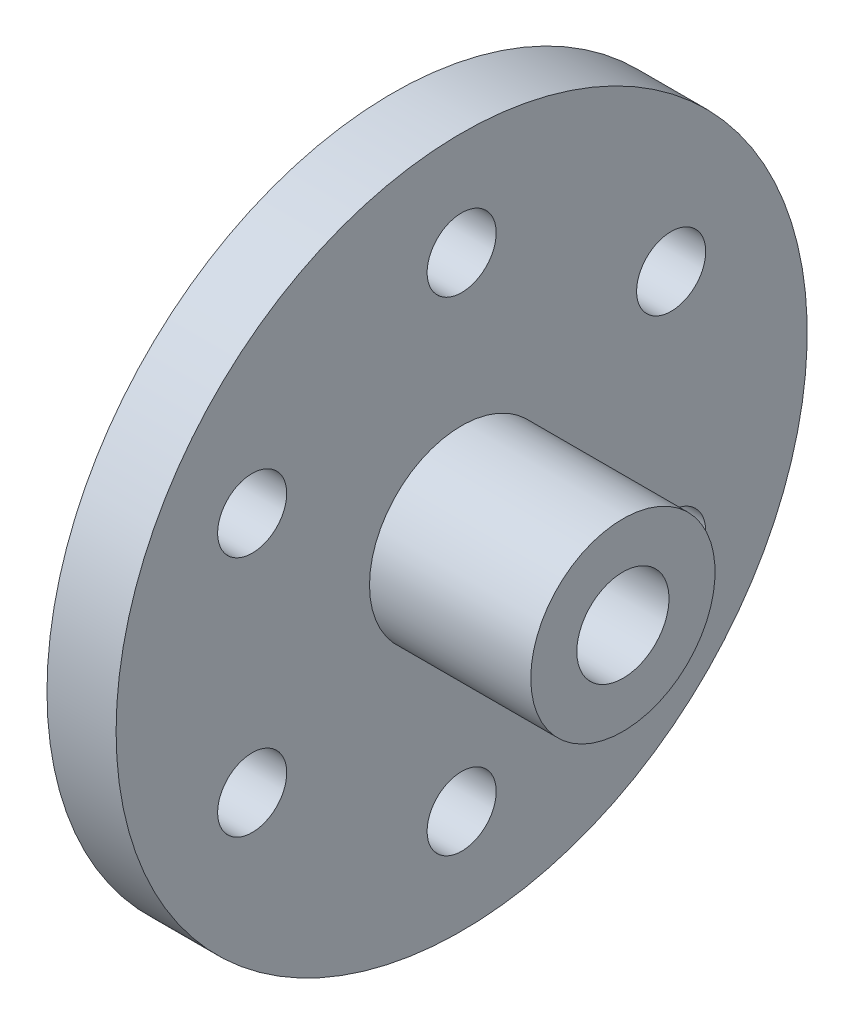
from build123d import *

# Parameters (mm, degrees)
SKETCH2_R          = 1.5
CUT_EXTRUDE5_DEPTH = 24.452078799


with BuildPart() as part:
    # Sketch1 → Revolve1 (revolve)
    with BuildSketch(Plane.XY, mode=Mode.PRIVATE) as revolve1_sk:
        Polygon((10, 4), (3, 4), (3, 15), (0, 15), (0, 2), (10, 2), align=None)
    revolve(revolve1_sk.sketch.rotate(Axis((0, 0, 0), (1, 0, 0)), 90), axis=Axis((0, 0, 0), (1, 0, 0)))

    # Sketch2 → Cut-Extrude5 (cut, through all)
    with BuildSketch(Plane.ZY):
        with Locations((0, 10.5)):
            Circle(SKETCH2_R)
        with Locations((9.09326674, 5.25)):
            Circle(SKETCH2_R)
        with Locations((9.09326674, -5.25)):
            Circle(SKETCH2_R)
        with Locations((0, -10.5)):
            Circle(SKETCH2_R)
        with Locations((-9.09326674, -5.25)):
            Circle(SKETCH2_R)
        with Locations((-9.09326674, 5.25)):
            Circle(SKETCH2_R)
    extrude(amount=-CUT_EXTRUDE5_DEPTH, mode=Mode.SUBTRACT)


solid = part.part
